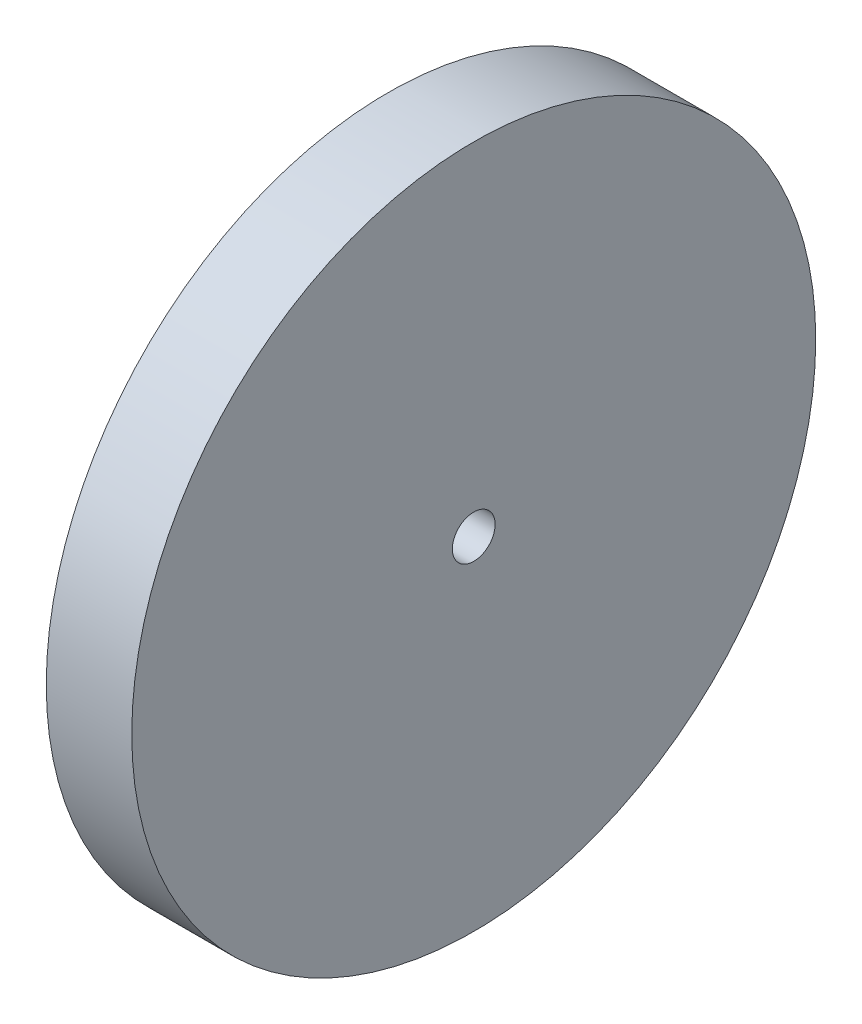
from build123d import *

# Parameters (mm, degrees)
SKETCH1_R           = 80
SKETCH1_R_2         = 5
BOSS_EXTRUDE1_DEPTH = 20


with BuildPart() as part:
    # Sketch1 → Boss-Extrude1 (new body)
    with BuildSketch(Plane(origin=(0, 0, 0), x_dir=(0, 0, -1), z_dir=(1, 0, 0))):
        Circle(SKETCH1_R)
        Circle(SKETCH1_R_2, mode=Mode.SUBTRACT)
    extrude(amount=BOSS_EXTRUDE1_DEPTH)


solid = part.part
